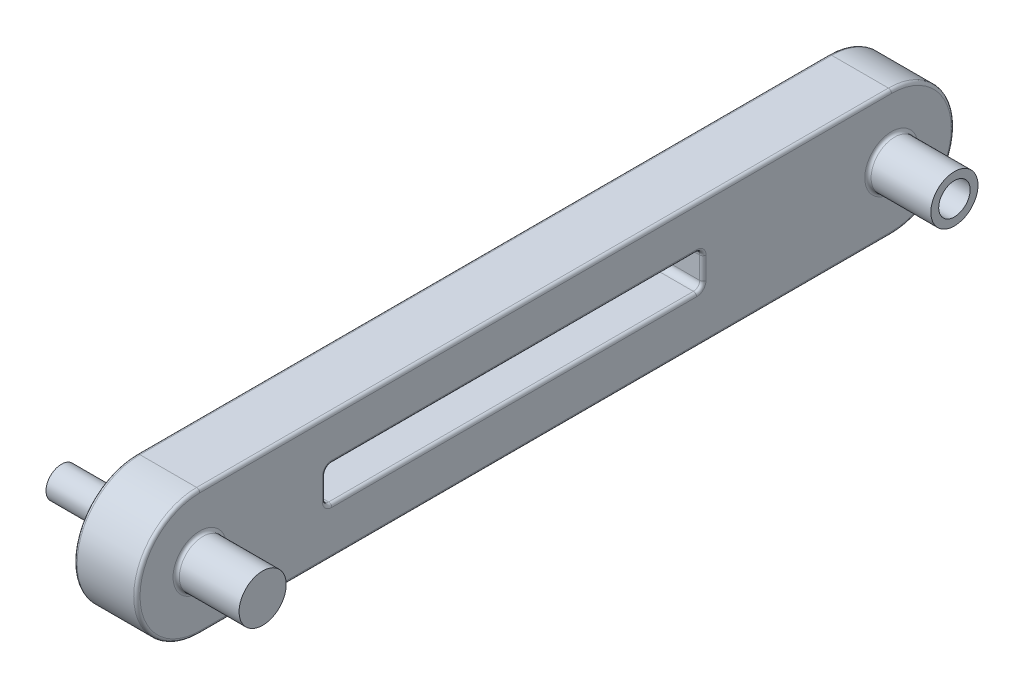
from build123d import *

# Parameters (mm, degrees)
SKETCH_1_R          = 3.75
EXTRUDE_1_DEPTH     = 10
SKETCH_2_R          = 3.75
EXTRUDE_2_DEPTH     = 10
SKETCH_3_R          = 2.5
CUT_EXTRUDE_1_DEPTH = 123.065556157
SKETCH_4_W          = 60
SKETCH_4_H          = 5.5
CUT_EXTRUDE_2_DEPTH = 10
FILLET_1_R          = 1
FILLET_2_R          = 0.5
SKETCH_5_R          = 2.45
EXTRUDE_3_DEPTH     = 12


with BuildPart() as part:
    # 草图1 → 凸台-拉伸1 (new body)
    with BuildSketch(Plane(origin=(0, 0, 0), x_dir=(0, 0, -1), z_dir=(1, 0, 0))):
        with BuildLine():
            Line((0, 10), (110, 10))
            ThreePointArc((110, 10), (120, 0), (110, -10))
            Line((110, -10), (0, -10))
            ThreePointArc((0, -10), (-10, 0), (0, 10))
        make_face()
        Circle(SKETCH_1_R, mode=Mode.SUBTRACT)
        with Locations((110, 0)):
            Circle(SKETCH_1_R, mode=Mode.SUBTRACT)
    extrude(amount=EXTRUDE_1_DEPTH)

    # 草图2 → 凸台-拉伸2 (add, symmetric)
    with BuildSketch(Plane(origin=(10, 0, 0), x_dir=(0, 0, -1), z_dir=(1, 0, 0))):
        with Locations((110, 0)):
            Circle(SKETCH_2_R)
        Circle(SKETCH_2_R)
    extrude(amount=EXTRUDE_2_DEPTH, both=True)

    # 草图3 → 切除-拉伸1 (cut, through all)
    with BuildSketch(Plane.ZY):
        with Locations((-110, 0)):
            Circle(SKETCH_3_R)
    extrude(amount=-CUT_EXTRUDE_1_DEPTH, mode=Mode.SUBTRACT)

    # 草图4 → 切除-拉伸2 (cut)
    with BuildSketch(Plane.ZY):
        with Locations((-50, 0.25)):
            Rectangle(SKETCH_4_W, SKETCH_4_H)
    extrude(amount=-CUT_EXTRUDE_2_DEPTH, mode=Mode.SUBTRACT)

    # 圆角1
    fillet_1_edges = [part.edges().sort_by_distance(p)[0] for p in [
        (5, -2.5, -80),
        (5, 3, -80),
        (5, 3, -20),
        (5, -2.5, -20),
    ]]
    fillet(fillet_1_edges, radius=FILLET_1_R)

    # 圆角2
    fillet_2_edges = [part.edges().sort_by_distance(p)[0] for p in [
        (10, 0, 3.75),
        (10, 0, -120),
        (10, 0, -106.25),
        (10, 10, -55),
        (0, 0, -112.5),
        (10, 0, 10),
        (0, 10, -55),
        (0, 0, -120),
        (0, 0.25, -20),
        (10, 0.25, -20),
        (0, -10, -55),
        (0, -2.5, -50),
        (10, -2.5, -50),
        (0, 3, -50),
        (0, 0, 10),
        (10, 3, -50),
        (0, 0.25, -80),
        (10, 0.25, -80),
        (0, -2.207106781, -20.292893219),
        (10, -2.207106781, -20.292893219),
        (0, 2.707106781, -20.292893219),
        (10, 2.707106781, -20.292893219),
        (0, 2.707106781, -79.707106781),
        (10, 2.707106781, -79.707106781),
        (0, -2.207106781, -79.707106781),
        (10, -2.207106781, -79.707106781),
        (10, -10, -55),
    ]]
    fillet(fillet_2_edges, radius=FILLET_2_R)

    # 草图5 → 凸台-拉伸3 (add)
    with BuildSketch(Plane.ZY):
        with Locations(Location((0, 0, 0), (0, 0, 180))):
            Circle(SKETCH_5_R)
    extrude(amount=EXTRUDE_3_DEPTH)


solid = part.part
